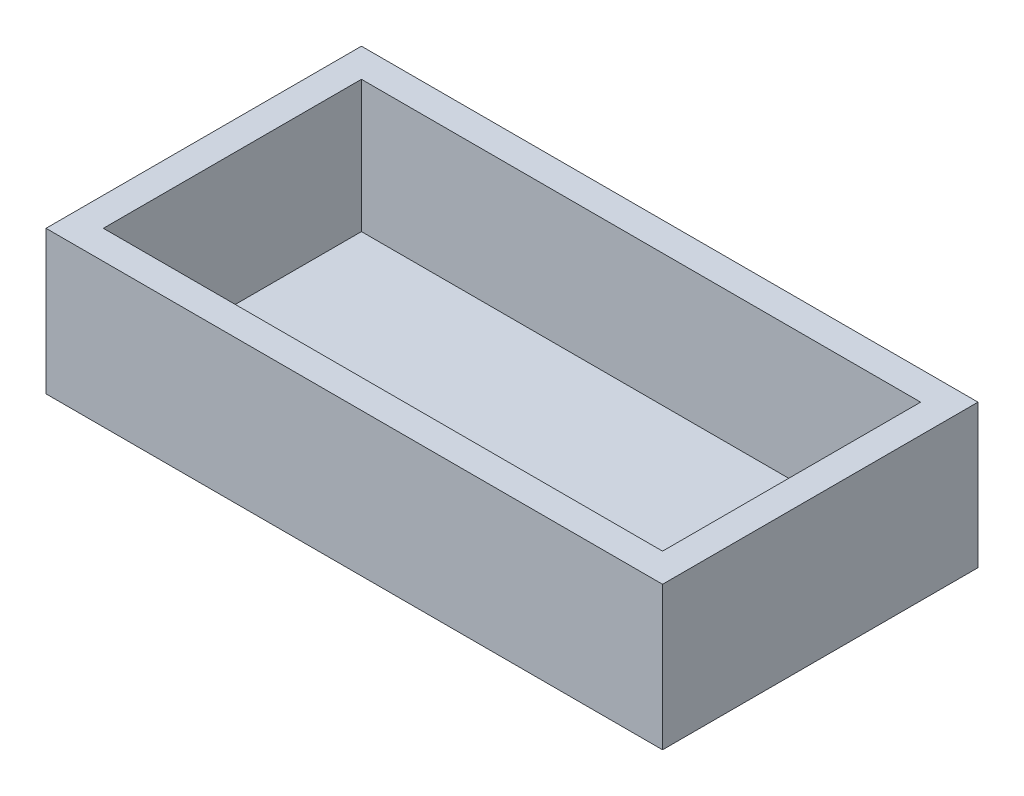
from build123d import *

# Parameters (mm, degrees)
SKETCH_1_W          = 43
SKETCH_1_H          = 22
EXTRUDE_2_DEPTH     = 10
SKETCH_3_W          = 39
SKETCH_3_H          = 18
CUT_EXTRUDE_1_DEPTH = 9.2
SKETCH_4_W          = 3.2
SKETCH_4_H          = 1.6
CUT_EXTRUDE_2_DEPTH = 2


with BuildPart() as part:
    # Эскиз1 → Бобышка-Вытянуть2 (new body)
    with BuildSketch(Plane(origin=(0, 0, 0), x_dir=(1, 0, 0), z_dir=(0, 1, 0))):
        Rectangle(SKETCH_1_W, SKETCH_1_H)
    extrude(amount=EXTRUDE_2_DEPTH)

    # Эскиз3 → Вырез-Вытянуть1 (cut)
    with BuildSketch(Plane(origin=(0, 10, 0), x_dir=(1, 0, 0), z_dir=(0, 1, 0))):
        Rectangle(SKETCH_3_W, SKETCH_3_H)
    extrude(amount=-CUT_EXTRUDE_1_DEPTH, mode=Mode.SUBTRACT)

    # Эскиз4 → Вырез-Вытянуть2 (cut)
    with BuildSketch(Plane(origin=(0, 0, -11), x_dir=(-1, 0, 0), z_dir=(0, 0, -1))):
        with Locations((-17.9, 2.8)):
            Rectangle(SKETCH_4_W, SKETCH_4_H)
    extrude(amount=-CUT_EXTRUDE_2_DEPTH, mode=Mode.SUBTRACT)


solid = part.part
